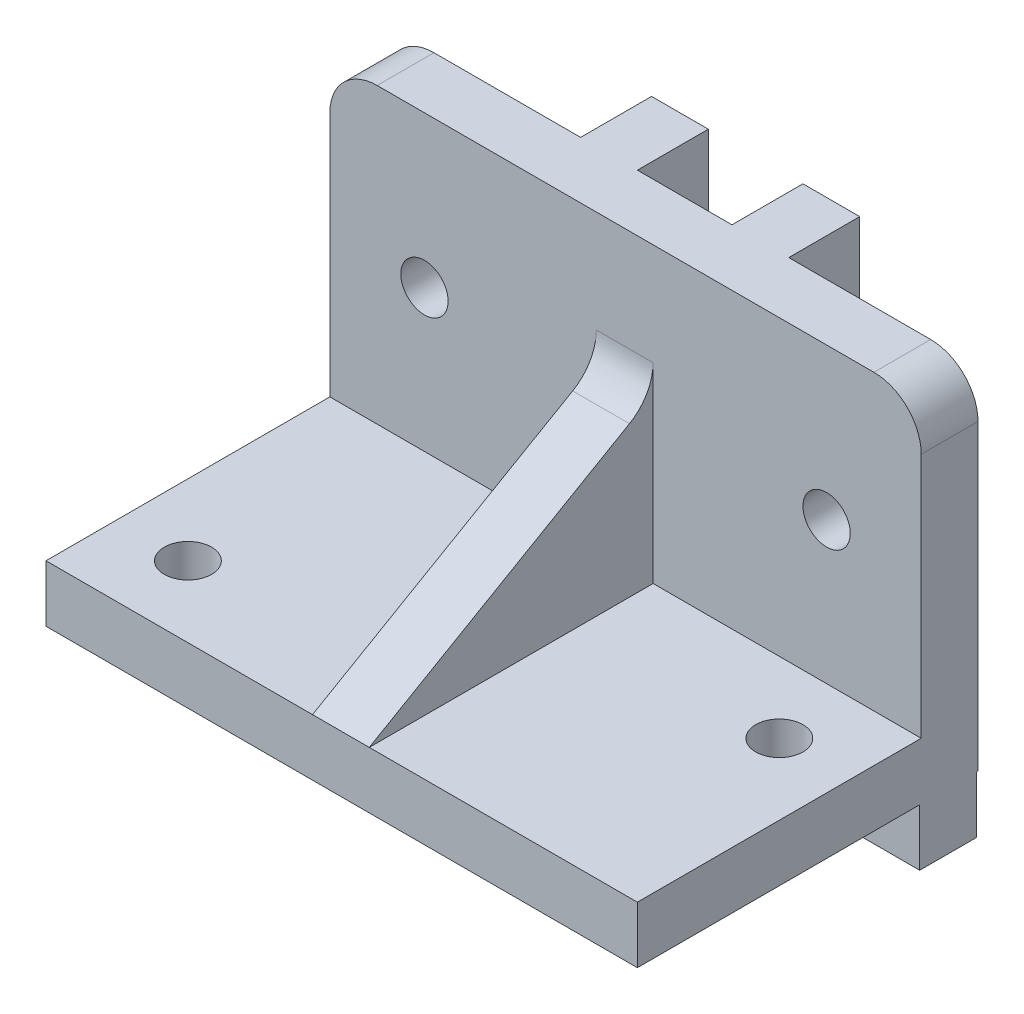
from build123d import *

# Parameters (mm, degrees)
SKETCH1_W              = 125
SKETCH1_H              = 12
BOSS_EXTRUDE1_DEPTH    = 72
SKETCH2_W              = 125
SKETCH2_H              = 12
BOSS_EXTRUDE2_DEPTH    = 62
SKETCH3_W              = 12
SKETCH3_H              = 74
BOSS_EXTRUDE3_DEPTH    = 15
SKETCH4_W              = 125
SKETCH4_H              = 12
BOSS_EXTRUDE4_DEPTH    = 12
FILLET1_R              = 10
SKETCH5_W              = 12
SKETCH5_H              = 62
BOSS_EXTRUDE5_DEPTH    = 60
CUT_EXTRUDE4_DEPTH     = 12
FILLET2_R              = 10
F_10_0MM_DOWEL_SLOT1_D = 10
F_10_0MM_DOWEL_SLOT2_D = 10


with BuildPart() as part:
    # Sketch1 → Boss-Extrude1 (new body)
    with BuildSketch(Plane.XY):
        Rectangle(SKETCH1_W, SKETCH1_H)
    extrude(amount=-BOSS_EXTRUDE1_DEPTH)

    # Sketch2 → Boss-Extrude2 (add)
    with BuildSketch(Plane(origin=(0, 6, 0), x_dir=(1, 0, 0), z_dir=(0, 1, 0))):
        with Locations((0, 66)):
            Rectangle(SKETCH2_W, SKETCH2_H)
    extrude(amount=BOSS_EXTRUDE2_DEPTH)

    # Sketch3 → Boss-Extrude3 (add)
    with BuildSketch(Plane(origin=(0, 0, -72), x_dir=(-1, 0, 0), z_dir=(0, 0, -1))):
        with Locations((-16.5, 31)):
            Rectangle(SKETCH3_W, SKETCH3_H)
        with Locations((15.5, 31)):
            Rectangle(SKETCH3_W, SKETCH3_H)
    extrude(amount=BOSS_EXTRUDE3_DEPTH)

    # Sketch4 → Boss-Extrude4 (add)
    with BuildSketch(Plane.XZ.offset(6)):
        with Locations((0, -65.675154964)):
            Rectangle(SKETCH4_W, SKETCH4_H)
    extrude(amount=BOSS_EXTRUDE4_DEPTH)

    # Fillet1
    fillet1_edges = [part.edges().sort_by_distance(p)[0] for p in [
        (-62.5, 68, -66),
        (62.5, 68, -66),
    ]]
    fillet(fillet1_edges, radius=FILLET1_R)

    # Sketch5 → Boss-Extrude5 (add)
    with BuildSketch(Plane.XY.offset(-60)):
        with Locations((-0.169803283, 37)):
            Rectangle(SKETCH5_W, SKETCH5_H)
    extrude(amount=BOSS_EXTRUDE5_DEPTH)

    # Sketch6 → Cut-Extrude4 (cut)
    with BuildSketch(Plane.ZY.offset(6.169803283)):
        Polygon((0, 6), (-60, 40.641016151), (-60, 68), (0, 68), align=None)
    extrude(amount=-CUT_EXTRUDE4_DEPTH, mode=Mode.SUBTRACT)

    # Fillet2
    fillet2_edges = [part.edges().sort_by_distance(p)[0] for p in [
        (-0.169803283, 40.641016151, -60),
    ]]
    fillet(fillet2_edges, radius=FILLET2_R)

    # Ø10.0mm Dowel Slot1 (through all)
    with Locations(Plane.XY.offset(-60)):
        with Locations((42.5, 36), (-42.5, 36)):
            Hole(F_10_0MM_DOWEL_SLOT1_D / 2)

    # Ø10.0mm Dowel Slot2 (through all)
    with Locations(Plane(origin=(0, 6, 0), x_dir=(1, 0, 0), z_dir=(0, 1, 0))):
        with Locations((-47.5, 15), (47.5, 45)):
            Hole(F_10_0MM_DOWEL_SLOT2_D / 2)


solid = part.part
